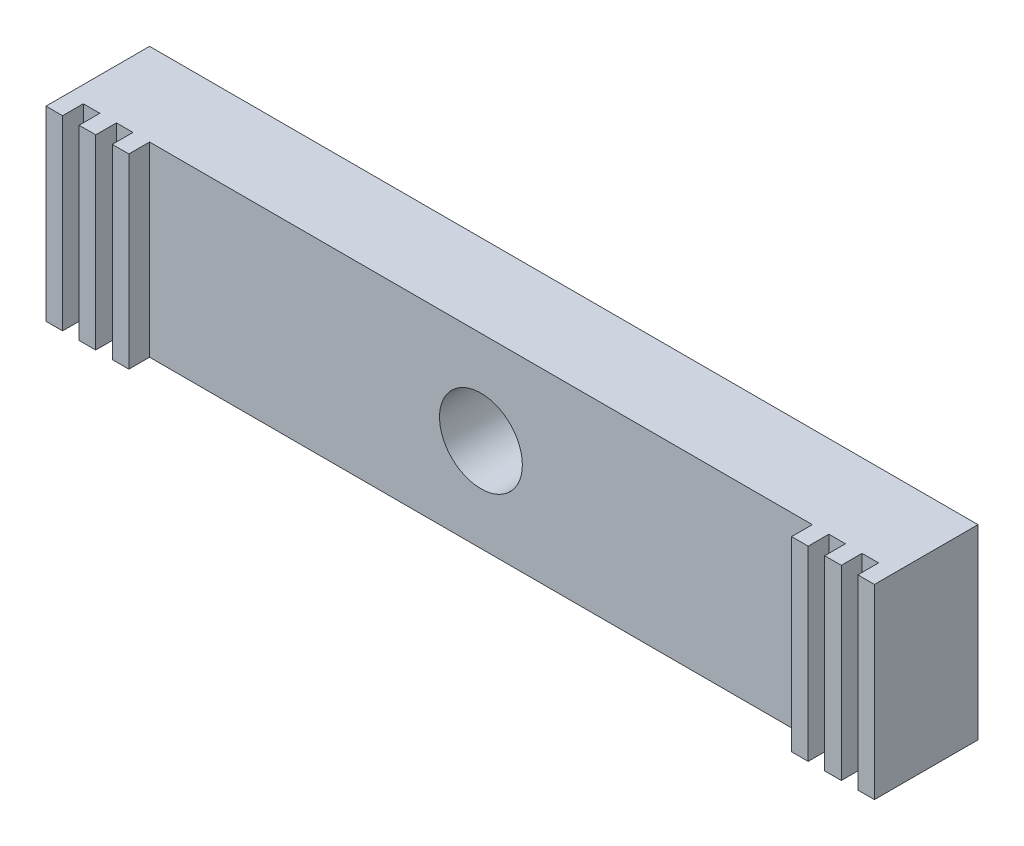
from build123d import *

# Parameters (mm, degrees)
SKETCH_1_W      = 40
SKETCH_1_H      = 9
SKETCH_1_R      = 2
EXTRUDE_1_DEPTH = 4
SKETCH_2_W      = 0.8
SKETCH_2_H      = 9
EXTRUDE_2_DEPTH = 1


with BuildPart() as part:
    # 草图1 → 凸台-拉伸1 (new body)
    with BuildSketch(Plane.XY):
        Rectangle(SKETCH_1_W, SKETCH_1_H)
        Circle(SKETCH_1_R, mode=Mode.SUBTRACT)
    extrude(amount=EXTRUDE_1_DEPTH)

    # 草图2 → 凸台-拉伸2 (add)
    with BuildSketch(Plane.XY.offset(4)):
        with Locations((-19.6, 0)):
            Rectangle(SKETCH_2_W, SKETCH_2_H)
        with Locations((-18, 0)):
            Rectangle(SKETCH_2_W, SKETCH_2_H)
        with Locations((-16.4, 0)):
            Rectangle(SKETCH_2_W, SKETCH_2_H)
        with Locations((16.4, 0)):
            Rectangle(SKETCH_2_W, SKETCH_2_H)
        with Locations((18, 0)):
            Rectangle(SKETCH_2_W, SKETCH_2_H)
        with Locations((19.6, 0)):
            Rectangle(SKETCH_2_W, SKETCH_2_H)
    extrude(amount=EXTRUDE_2_DEPTH)


solid = part.part
